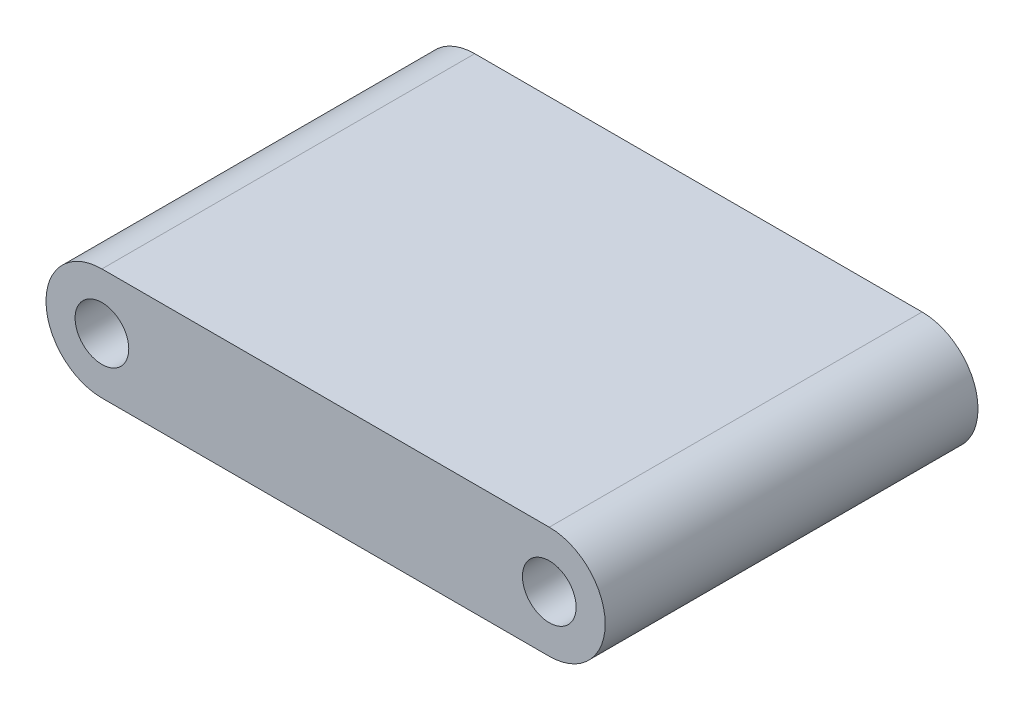
from build123d import *

# Parameters (mm, degrees)
SKETCH1_R           = 2.286
BOSS_EXTRUDE1_DEPTH = 31.75


with BuildPart() as part:
    # Sketch1 → Boss-Extrude1 (new body)
    with BuildSketch(Plane.XY):
        with BuildLine():
            Line((0, 4.7625), (38.1, 4.7625))
            ThreePointArc((38.1, 4.7625), (42.8625, 0), (38.1, -4.7625))
            Line((38.1, -4.7625), (0, -4.7625))
            ThreePointArc((0, -4.7625), (-4.7625, 0), (0, 4.7625))
        make_face()
        Circle(SKETCH1_R, mode=Mode.SUBTRACT)
        with Locations((38.1, 0)):
            Circle(SKETCH1_R, mode=Mode.SUBTRACT)
    extrude(amount=BOSS_EXTRUDE1_DEPTH)


solid = part.part
